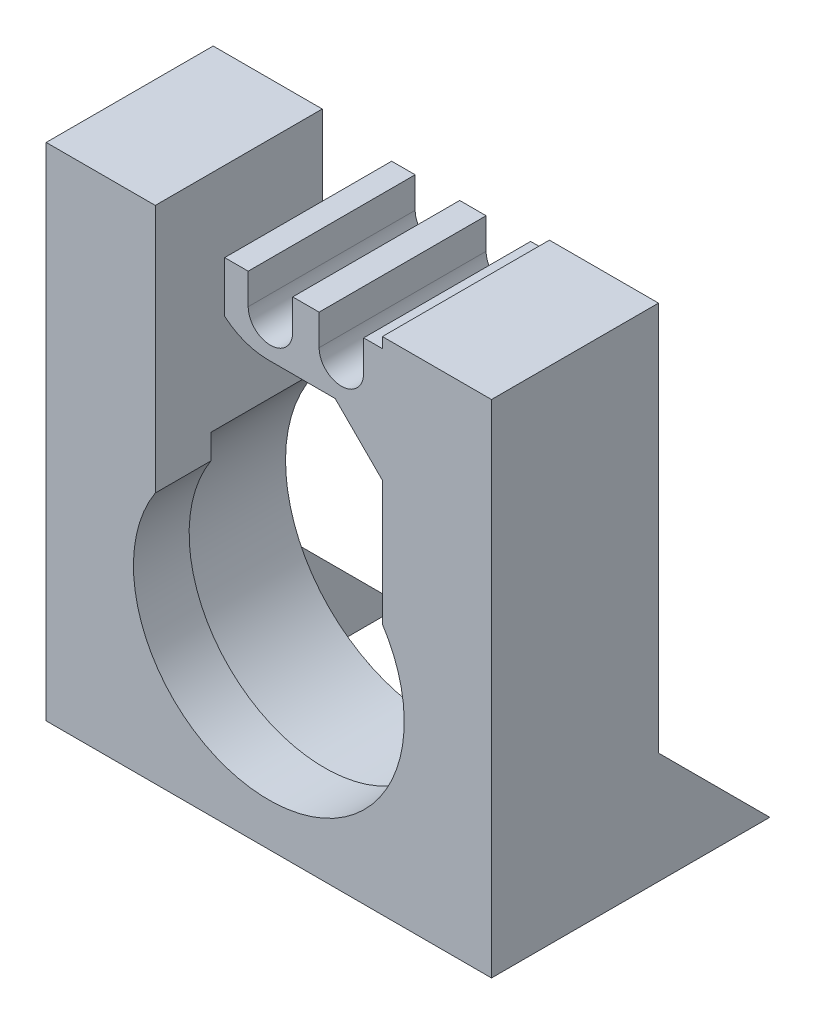
from build123d import *

# Parameters (mm, degrees)
EXTRUDE_1_DEPTH = 10
EXTRUDE_2_DEPTH = 5
EXTRUDE_3_DEPTH = 7
EXTRUDE_4_DEPTH = 7
EXTRUDE_5_DEPTH = 15


with BuildPart() as part:
    # 草图2 → 凸台-拉伸1 (new body)
    with BuildSketch(Plane.XY):
        with BuildLine():
            Line((13.103017853, 56.387526043), (13.103017853, 11.387526043))
            Line((13.103017853, 11.387526043), (53.103017853, 11.387526043))
            Line((53.103017853, 11.387526043), (53.103017853, 56.387526043))
            Line((53.103017853, 56.387526043), (43.304310597, 56.387526043))
            Line((43.304310597, 56.387526043), (43.304310597, 36.238634876))
            ThreePointArc((43.304310597, 36.238634876), (33.103017853, 13.896484325), (22.901725109, 36.238634876))
            Line((22.901725109, 36.238634876), (22.901725109, 56.387526043))
            Line((22.901725109, 56.387526043), (13.103017853, 56.387526043))
        make_face()
    extrude(amount=EXTRUDE_1_DEPTH)

    # 草图3 → 凸台-拉伸2 (add)
    with BuildSketch(Plane.XY.offset(10)):
        with BuildLine():
            Line((13.103017853, 56.387526043), (22.901725109, 56.387526043))
            Line((22.901725109, 56.387526043), (22.901725109, 34.014582719))
            ThreePointArc((22.901725109, 34.014582719), (33.103017853, 15.236484325), (43.304310597, 34.014582719))
            Line((43.304310597, 34.014582719), (43.304310597, 56.387526043))
            Line((43.304310597, 56.387526043), (53.103017853, 56.387526043))
            Line((53.103017853, 56.387526043), (53.103017853, 11.387526043))
            Line((53.103017853, 11.387526043), (13.103017853, 11.387526043))
            Line((13.103017853, 11.387526043), (13.103017853, 56.387526043))
        make_face()
    extrude(amount=EXTRUDE_2_DEPTH)

    # 草图4 → 凸台-拉伸3 (add)
    with BuildSketch(Plane(origin=(53.103017853, 0, 0), x_dir=(0, 0, -1), z_dir=(1, 0, 0))):
        Polygon((0, 21.387526043), (10, 11.387526043), (0, 11.387526043), align=None)
    extrude(amount=-EXTRUDE_3_DEPTH)

    # 草图6 → 凸台-拉伸5 (add)
    with BuildSketch(Plane.XY.offset(15)):
        with BuildLine():
            Line((43.304310597, 45.201054381), (39.06166991, 49.443695069))
            Line((39.06166991, 49.443695069), (33.025383011, 49.443695069))
            ThreePointArc((33.025383011, 49.443695069), (30.953267542, 49.812856989), (29.136134115, 50.874915908))
            Line((29.136134115, 50.874915908), (29.136134115, 55.443695069))
            Line((29.136134115, 55.443695069), (31.246885218, 55.443695069))
            Line((31.246885218, 55.443695069), (31.246885218, 52.67922364))
            ThreePointArc((31.246885218, 52.67922364), (33.246885218, 50.67922364), (35.246885218, 52.67922364))
            Line((35.246885218, 52.67922364), (35.246885218, 55.443695069))
            Line((35.246885218, 55.443695069), (37.619354406, 55.443695069))
            Line((37.619354406, 55.443695069), (37.619354406, 52.67922364))
            ThreePointArc((37.619354406, 52.67922364), (39.619354406, 50.67922364), (41.619354406, 52.67922364))
            Line((41.619354406, 52.67922364), (41.619354406, 55.443695069))
            Line((41.619354406, 55.443695069), (43.304310597, 55.443695069))
            Line((43.304310597, 55.443695069), (43.304310597, 45.201054381))
        make_face()
    extrude(amount=-EXTRUDE_5_DEPTH)


with BuildPart() as body_2:
    # 草图5 → 凸台-拉伸4 (new body)
    with BuildSketch(Plane.ZY.offset(-13.103017853)):
        Polygon((0, 11.387526043), (-10, 11.387526043), (0, 21.387526043), align=None)
    extrude(amount=-EXTRUDE_4_DEPTH)


solid = Compound([part.part, body_2.part])
